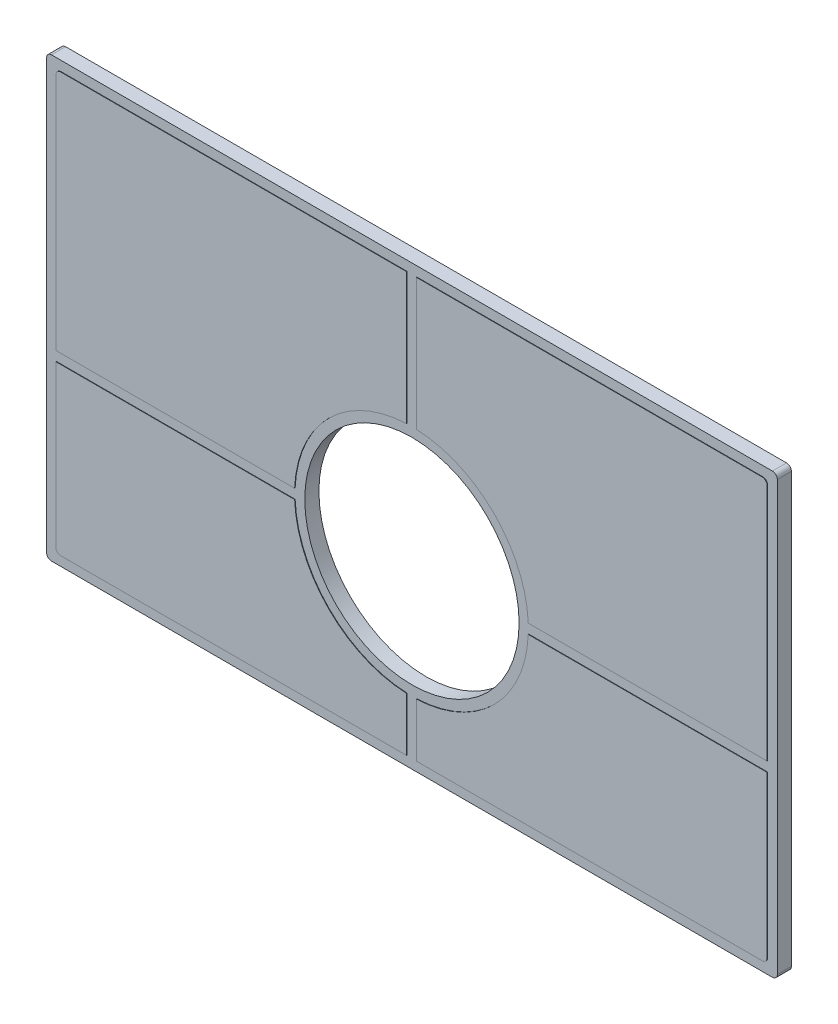
from build123d import *

# Parameters (mm, degrees)
SKETCH_1_R          = 22
EXTRUDE_1_DEPTH     = 3
SKETCH_6_R          = 24
CUT_EXTRUDE_1_DEPTH = 0.1
SKETCH_7_W          = 161.718450326
SKETCH_7_H          = 100.382420291
CUT_EXTRUDE_2_DEPTH = 0.1
SKETCH_8_W          = 2
SKETCH_8_H          = 101.647080703
CUT_EXTRUDE_3_DEPTH = 0.1
SKETCH_9_W          = 185.430833072
SKETCH_9_H          = 2
CUT_EXTRUDE_4_DEPTH = 0.1


with BuildPart() as part:
    # Эскиз1 → Бобышка-Вытянуть1 (new body)
    with BuildSketch(Plane.XY):
        with BuildLine():
            Line((-74, 53), (74, 53))
            ThreePointArc((74, 53), (74.707106781, 52.707106781), (75, 52))
            Line((75, 52), (75, -36))
            ThreePointArc((75, -36), (74.707106781, -36.707106781), (74, -37))
            Line((74, -37), (-74, -37))
            ThreePointArc((-74, -37), (-74.707106781, -36.707106781), (-75, -36))
            Line((-75, -36), (-75, 52))
            ThreePointArc((-75, 52), (-74.707106781, 52.707106781), (-74, 53))
        make_face()
        Circle(SKETCH_1_R, mode=Mode.SUBTRACT)
    extrude(amount=EXTRUDE_1_DEPTH)

    # Эскиз6 → Вырез-Вытянуть1 (cut)
    with BuildSketch(Plane.XY.offset(3)):
        Circle(SKETCH_6_R)
    extrude(amount=-CUT_EXTRUDE_1_DEPTH, mode=Mode.SUBTRACT)

    # Эскиз7 → Вырез-Вытянуть2 (cut)
    with BuildSketch(Plane.XY.offset(3)):
        with Locations((0.395206379, 8.158082552)):
            Rectangle(SKETCH_7_W, SKETCH_7_H)
        with BuildLine():
            Line((72, 51), (-72, 51))
            ThreePointArc((-72, 51), (-72.707106781, 50.707106781), (-73, 50))
            Line((-73, 50), (-73, -34))
            ThreePointArc((-73, -34), (-72.707106781, -34.707106781), (-72, -35))
            Line((-72, -35), (72, -35))
            ThreePointArc((72, -35), (72.707106781, -34.707106781), (73, -34))
            Line((73, -34), (73, 50))
            ThreePointArc((73, 50), (72.707106781, 50.707106781), (72, 51))
        make_face(mode=Mode.SUBTRACT)
    extrude(amount=-CUT_EXTRUDE_2_DEPTH, mode=Mode.SUBTRACT)

    # Эскиз8 → Вырез-Вытянуть3 (cut)
    with BuildSketch(Plane.XY.offset(3)):
        with Locations((0, 5.154514071)):
            Rectangle(SKETCH_8_W, SKETCH_8_H)
    extrude(amount=-CUT_EXTRUDE_3_DEPTH, mode=Mode.SUBTRACT)

    # Эскиз9 → Вырез-Вытянуть4 (cut)
    with BuildSketch(Plane.XY.offset(3)):
        with Locations((6.718508445, 0)):
            Rectangle(SKETCH_9_W, SKETCH_9_H)
    extrude(amount=-CUT_EXTRUDE_4_DEPTH, mode=Mode.SUBTRACT)


solid = part.part
